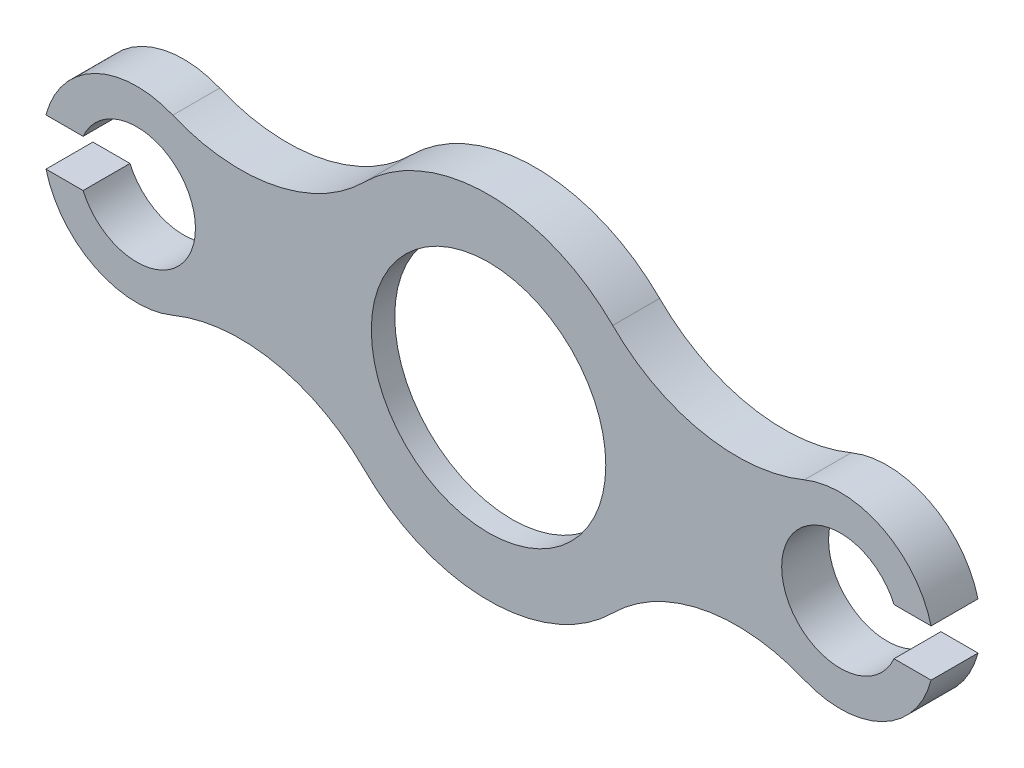
from build123d import *

# Parameters (mm, degrees)
BOSS_EXTRUDE8_DEPTH = 20
SKETCH5_R           = 50
CUT_EXTRUDE1_DEPTH  = 10
SKETCH7_R           = 67.8
CUT_EXTRUDE3_DEPTH  = 10


with BuildPart() as part:
    # Sketch3 → Boss-Extrude8 (new body)
    with BuildSketch(Plane.XY):
        with BuildLine():
            ThreePointArc((134.666666667, -36.944402673), (110, 0), (134.666666667, 36.944402673))
            ThreePointArc((134.666666667, 36.944402673), (91.362529225, 32.640861336), (52.958333333, 53.107578843))
            ThreePointArc((52.958333333, 53.107578843), (0, 75), (-52.958333333, 53.107578843))
            ThreePointArc((-52.958333333, 53.107578843), (-91.362529225, 32.640861336), (-134.666666667, 36.944402673))
            ThreePointArc((-134.666666667, 36.944402673), (-110, 0), (-134.666666667, -36.944402673))
            ThreePointArc((-134.666666667, -36.944402673), (-91.362529225, -32.640861336), (-52.958333333, -53.107578843))
            ThreePointArc((-52.958333333, -53.107578843), (0, -75), (52.958333333, -53.107578843))
            ThreePointArc((52.958333333, -53.107578843), (91.362529225, -32.640861336), (134.666666667, -36.944402673))
        make_face()
        with BuildLine():
            ThreePointArc((-188.729833462, 10), (-110, 0), (-188.729833462, -10))
            Line((-188.729833462, -10), (-172.912878475, -10))
            ThreePointArc((-172.912878475, -10), (-125, 0), (-172.912878475, 10))
            Line((-172.912878475, 10), (-188.729833462, 10))
        make_face()
        with BuildLine():
            ThreePointArc((172.912878475, 10), (125, 0), (172.912878475, -10))
            Line((172.912878475, -10), (188.729833462, -10))
            ThreePointArc((188.729833462, -10), (110, 0), (188.729833462, 10))
            Line((188.729833462, 10), (172.912878475, 10))
        make_face()
    extrude(amount=BOSS_EXTRUDE8_DEPTH)

    # Sketch5 → Cut-Extrude1 (cut)
    with BuildSketch(Plane.XY.offset(20)):
        Circle(SKETCH5_R)
    extrude(amount=-CUT_EXTRUDE1_DEPTH, mode=Mode.SUBTRACT)

    # Sketch7 → Cut-Extrude3 (cut)
    with BuildSketch(Plane(origin=(0, 0, 0), x_dir=(-1, 0, 0), z_dir=(0, 0, -1))):
        Circle(SKETCH7_R)
    extrude(amount=-CUT_EXTRUDE3_DEPTH, mode=Mode.SUBTRACT)


solid = part.part
